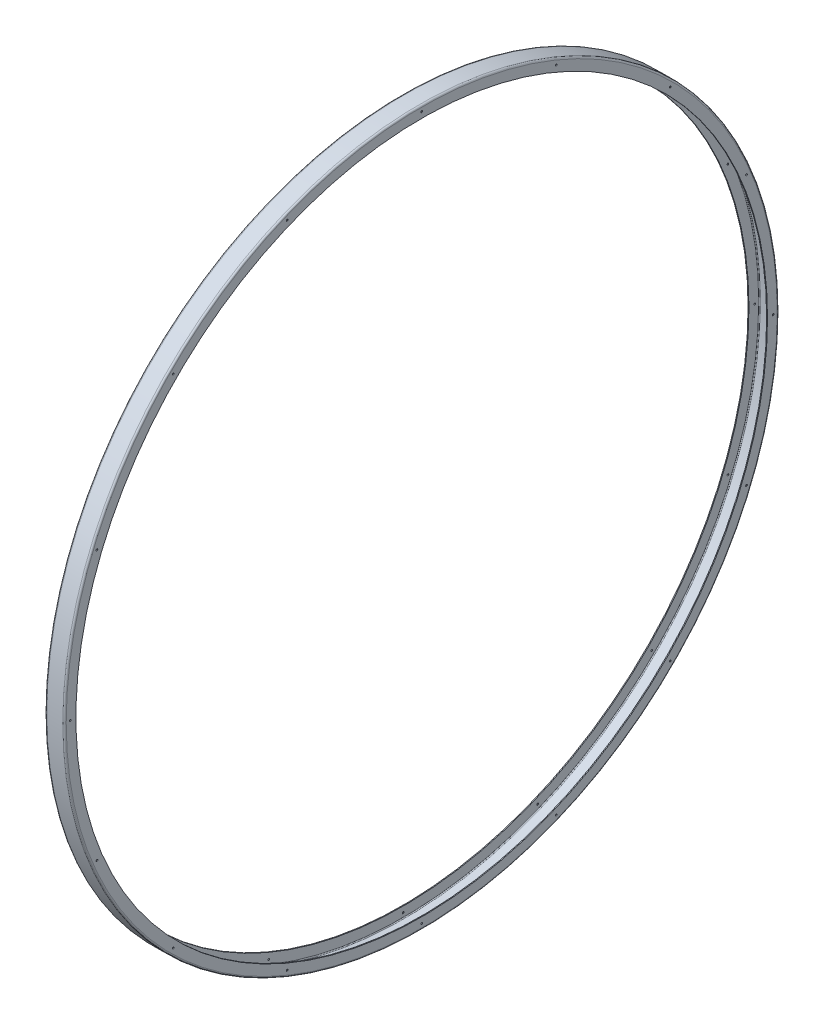
from build123d import *

# Parameters (mm, degrees)
SKETCH2_R          = 3
CUT_EXTRUDE1_DEPTH = 2766.552386142
CIRPATTERN1_COUNT  = 16


with BuildPart() as part:
    # Sketch1 → Revolve1 (revolve)
    with BuildSketch(Plane(origin=(0, 0, 0), x_dir=(1, 0, 0), z_dir=(0, 1, 0))):
        with BuildLine():
            Line((11.515151515, 34), (-44.484848485, 34))
            ThreePointArc((-44.484848485, 34), (-48.727489172, 32.242640687), (-50.484848485, 28))
            Line((-50.484848485, 28), (-50.484848485, -6))
            Line((-50.484848485, -6), (-47.484848485, -6))
            Line((-47.484848485, -6), (-47.484848485, 28))
            ThreePointArc((-47.484848485, 28), (-46.606168828, 30.121320344), (-44.484848485, 31))
            Line((-44.484848485, 31), (11.515151515, 31))
            ThreePointArc((11.515151515, 31), (13.636471859, 30.121320344), (14.515151515, 28))
            Line((14.515151515, 28), (14.515151515, -6))
            Line((14.515151515, -6), (17.515151515, -6))
            Line((17.515151515, -6), (17.515151515, 28))
            ThreePointArc((17.515151515, 28), (15.757792202, 32.242640687), (11.515151515, 34))
        make_face()
    revolve(axis=Axis((-31.365035631, 0, 1216), (-1, 0, 0)))

    # Sketch2 → Cut-Extrude1 (cut, symmetric)
    with BuildSketch(Plane(origin=(17.515151515, 0, 0), x_dir=(0, 0, -1), z_dir=(1, 0, 0))):
        with Locations((14, 0)):
            Circle(SKETCH2_R)
    cut_extrude1 = extrude(amount=CUT_EXTRUDE1_DEPTH, both=True, mode=Mode.SUBTRACT)

    # CirPattern1: Cut-Extrude1 ×16 about axis
    cirpattern1_axis = Axis((0, 0, 1216), (1, 0, 0))
    for i in range(1, CIRPATTERN1_COUNT):
        add(cut_extrude1.rotate(cirpattern1_axis, i * 360 / CIRPATTERN1_COUNT), mode=Mode.SUBTRACT)


solid = part.part
